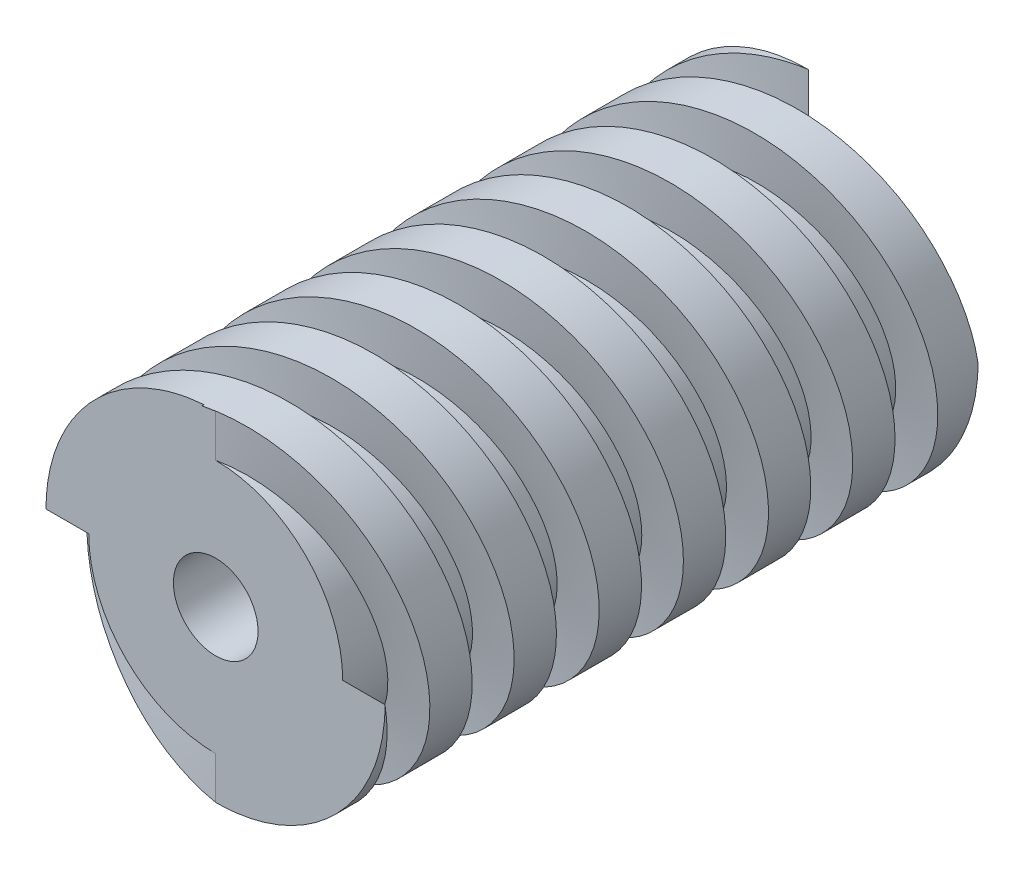
from build123d import *

# Parameters (mm, degrees)
SKETCH2_R               = 1.5
BOSS_EXTRUDE1_DEPTH     = 7
SWEEP1_PITCH            = 2
SWEEP1_HEIGHT           = 7.5
SWEEP1_RADIUS           = 2
SKETCH5_W               = 0.50487755
SKETCH5_H               = 0.5
SWEEP2_PITCH            = 2
SWEEP2_HEIGHT           = 7.5
SWEEP2_RADIUS           = 2
SWEEP2_START_ANGLE      = 180
SKETCH6_W               = 0.5
SKETCH6_H               = 0.5
CUT_EXTRUDE1_DEPTH      = 9.018050785
CUT_EXTRUDE1_DEPTH_BACK = 9.018050785
SKETCH8_W               = 0.5
SKETCH8_H               = 4
SKETCH8_H_2             = 4.221172624
SKETCH9_R               = 0.5
CUT_EXTRUDE2_DEPTH      = 8.552425988


with BuildPart() as part:
    # Sketch2 → Boss-Extrude1 (new body)
    with BuildSketch(Plane.XY):
        Circle(SKETCH2_R)
    extrude(amount=BOSS_EXTRUDE1_DEPTH)

    # Sweep1: sweep along a helix
    with BuildLine() as sweep1_path:
        Helix(SWEEP1_PITCH, SWEEP1_HEIGHT, SWEEP1_RADIUS, center=(0, 0, 7.5), direction=(0, 0, -1))
    # Sketch5 → Sweep1 (sweep)
    with BuildSketch(Plane(origin=(0, 0, 0), x_dir=(1, 0, 0), z_dir=(0, 1, 0))):
        with Locations((-1.752438775, -7.25)):
            Rectangle(SKETCH5_W, SKETCH5_H)
    sweep(path=sweep1_path.line, is_frenet=True)

    # Sweep2: sweep along a helix
    with BuildLine() as sweep2_path:
        add(Helix(SWEEP2_PITCH, SWEEP2_HEIGHT, SWEEP2_RADIUS, center=(0, 0, 7.5), direction=(0, 0, -1), mode=Mode.PRIVATE).rotate(Axis((0, 0, 7.5), (0, 0, -1)), SWEEP2_START_ANGLE))
    # Sketch6 → Sweep2 (sweep)
    with BuildSketch(Plane(origin=(0, 0, 0), x_dir=(1, 0, 0), z_dir=(0, 1, 0))):
        with Locations((1.75, -7.25)):
            Rectangle(SKETCH6_W, SKETCH6_H)
    sweep(path=sweep2_path.line, is_frenet=True)

    # Sketch8 → Cut-Extrude1 (cut, two sides: drawn at the far end of the back side and taken through both)
    with BuildSketch(Plane(origin=(0, 0, 0), x_dir=(0, 0, -1), z_dir=(1, 0, 0)).offset(-CUT_EXTRUDE1_DEPTH_BACK)):
        with Locations((-7.25, 0)):
            Rectangle(SKETCH8_W, SKETCH8_H)
        with Locations((0.25, -0.110586312)):
            Rectangle(SKETCH8_W, SKETCH8_H_2)
    extrude(amount=CUT_EXTRUDE1_DEPTH + CUT_EXTRUDE1_DEPTH_BACK, mode=Mode.SUBTRACT)

    # Sketch9 → Cut-Extrude2 (cut, through all)
    with BuildSketch(Plane.XY.offset(7)):
        Circle(SKETCH9_R)
    extrude(amount=-CUT_EXTRUDE2_DEPTH, mode=Mode.SUBTRACT)


solid = part.part
